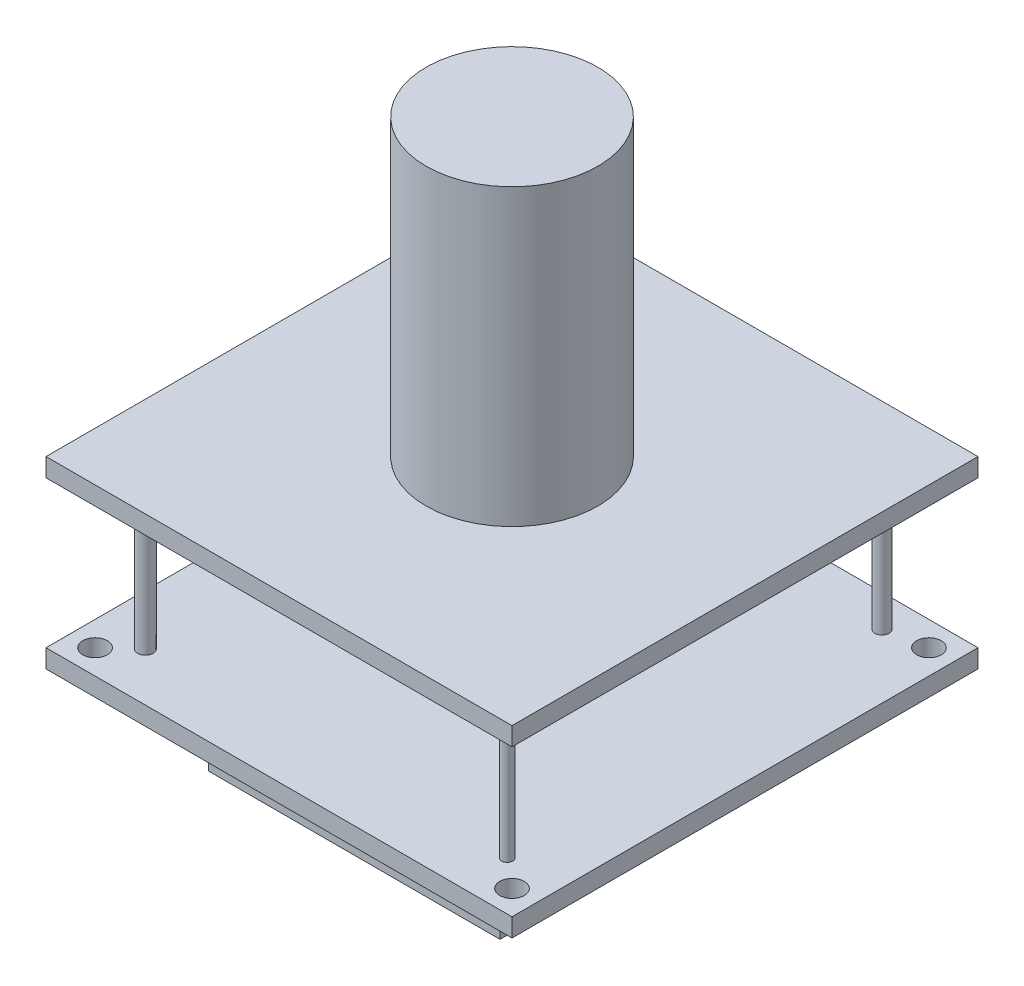
from build123d import *

# Parameters (mm, degrees)
SKETCH_1_W      = 38
SKETCH_1_H      = 38
SKETCH_1_R      = 1
EXTRUDE_1_DEPTH = 1.5
SKETCH_2_R      = 0.636700884
SKETCH_2_R_2    = 0.447912605
SKETCH_2_R_3    = 0.577059181
SKETCH_2_R_4    = 0.454786346
EXTRUDE_2_DEPTH = 12
SKETCH_3_W      = 38
SKETCH_3_H      = 38
EXTRUDE_3_DEPTH = 1.5
SKETCH_4_R      = 7
EXTRUDE_4_DEPTH = 24
SKETCH_5_W      = 23.785325885
SKETCH_5_H      = 24.83133448
SKETCH_5_W_2    = 7.276581533
SKETCH_5_H_2    = 1.922772716
EXTRUDE_5_DEPTH = 6.6


with BuildPart() as part:
    # 草图1 → 凸台-拉伸1 (new body)
    with BuildSketch(Plane(origin=(0, 0, 0), x_dir=(1, 0, 0), z_dir=(0, 1, 0))):
        with Locations((19, -19)):
            Rectangle(SKETCH_1_W, SKETCH_1_H)
        with Locations(Location((2, -2, 0), (0, 0, 270))):
            Circle(SKETCH_1_R, mode=Mode.SUBTRACT)
        with Locations(Location((36, -2, 0), (0, 0, 270))):
            Circle(SKETCH_1_R, mode=Mode.SUBTRACT)
        with Locations(Location((36, -36, 0), (0, 0, 270))):
            Circle(SKETCH_1_R, mode=Mode.SUBTRACT)
        with Locations(Location((2, -36, 0), (0, 0, 270))):
            Circle(SKETCH_1_R, mode=Mode.SUBTRACT)
    extrude(amount=EXTRUDE_1_DEPTH)

    # 草图2 → 凸台-拉伸2 (add)
    with BuildSketch(Plane(origin=(0, 1.5, 0), x_dir=(1, 0, 0), z_dir=(0, 1, 0))):
        with Locations(Location((4.128486493, -34.030688728, 0), (0, 0, 270))):
            Circle(SKETCH_2_R)
        with Locations(Location((4.765187377, -3.05973858, 0), (0, 0, 270))):
            Circle(SKETCH_2_R_2)
        with Locations(Location((32.780026277, -2.611825975, 0), (0, 0, 270))):
            Circle(SKETCH_2_R_3)
        with Locations(Location((33.644120334, -34.030688728, 0), (0, 0, 270))):
            Circle(SKETCH_2_R_4)
    extrude(amount=EXTRUDE_2_DEPTH)

    # 草图3 → 凸台-拉伸3 (add)
    with BuildSketch(Plane(origin=(0, 13.5, 0), x_dir=(1, 0, 0), z_dir=(0, 1, 0))):
        with Locations((19, -19)):
            Rectangle(SKETCH_3_W, SKETCH_3_H)
    extrude(amount=EXTRUDE_3_DEPTH)

    # 草图4 → 凸台-拉伸4 (add)
    with BuildSketch(Plane(origin=(0, 15, 0), x_dir=(1, 0, 0), z_dir=(0, 1, 0))):
        with Locations(Location((19, -19, 0), (0, 0, 270))):
            Circle(SKETCH_4_R)
    extrude(amount=EXTRUDE_4_DEPTH)

    # 草图5 → 凸台-拉伸5 (add)
    with BuildSketch(Plane(origin=(0, 0, 0), x_dir=(-1, 0, 0), z_dir=(0, -1, 0))):
        with Locations((-19.113696587, -19.568482932)):
            Rectangle(SKETCH_5_W, SKETCH_5_H)
        with Locations((-18.818085462, -0.961386358)):
            Rectangle(SKETCH_5_W_2, SKETCH_5_H_2)
    extrude(amount=EXTRUDE_5_DEPTH)


solid = part.part
